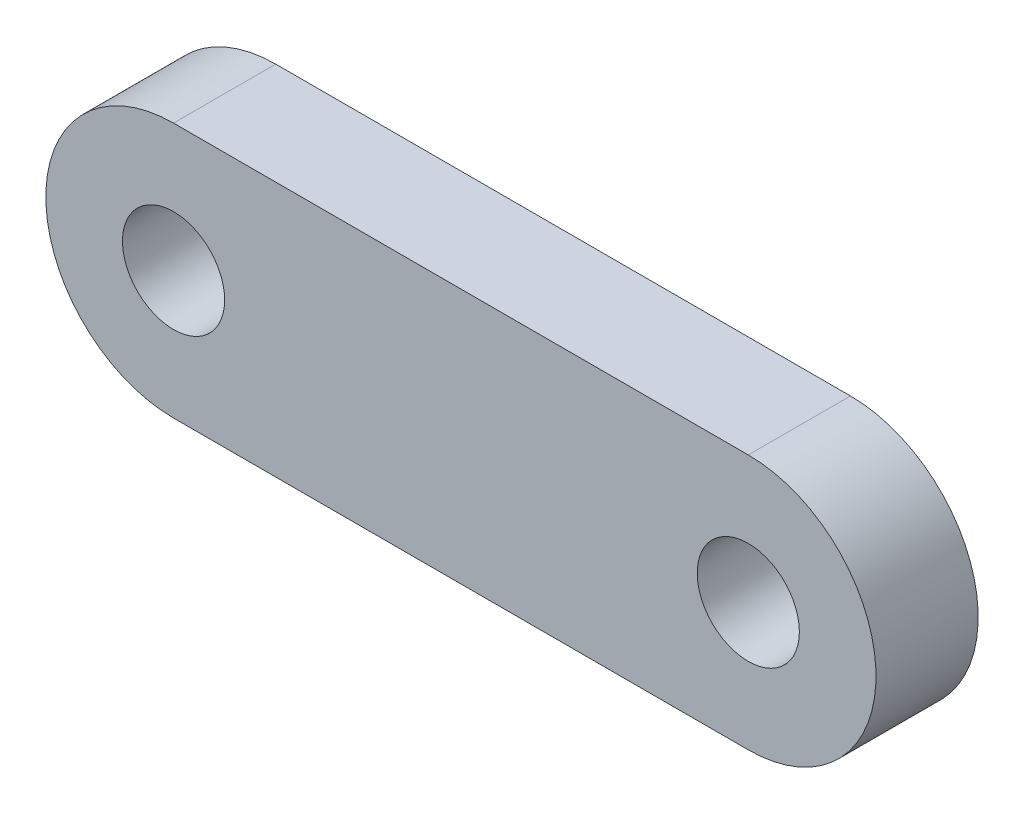
from build123d import *

# Parameters (mm, degrees)
SKETCH1_R           = 3.175
SKETCH1_R_2         = 1.27
BOSS_EXTRUDE1_DEPTH = 2.54


with BuildPart() as part:
    # Sketch1 → Boss-Extrude1 (new body)
    # profile 1 of 3: a face of its own
    with BuildSketch(Plane.XY):
        with BuildLine():
            Line((14.2875, 3.175), (0, 3.175))
            ThreePointArc((0, 3.175), (2.24506403, 2.24506403), (3.175, 0))
            ThreePointArc((3.175, 0), (2.24506403, -2.24506403), (0, -3.175))
            Line((0, -3.175), (14.2875, -3.175))
            ThreePointArc((14.2875, -3.175), (11.1125, 0), (14.2875, 3.175))
        make_face()
    # profile 2 of 3: a face of its own
    with BuildSketch(Plane.XY):
        Circle(SKETCH1_R)
        Circle(SKETCH1_R_2, mode=Mode.SUBTRACT)
    # profile 3 of 3: a face of its own
    with BuildSketch(Plane.XY):
        with Locations((14.2875, 0)):
            Circle(SKETCH1_R)
        with Locations((14.2875, 0)):
            Circle(SKETCH1_R_2, mode=Mode.SUBTRACT)
    extrude(amount=BOSS_EXTRUDE1_DEPTH)


solid = part.part
